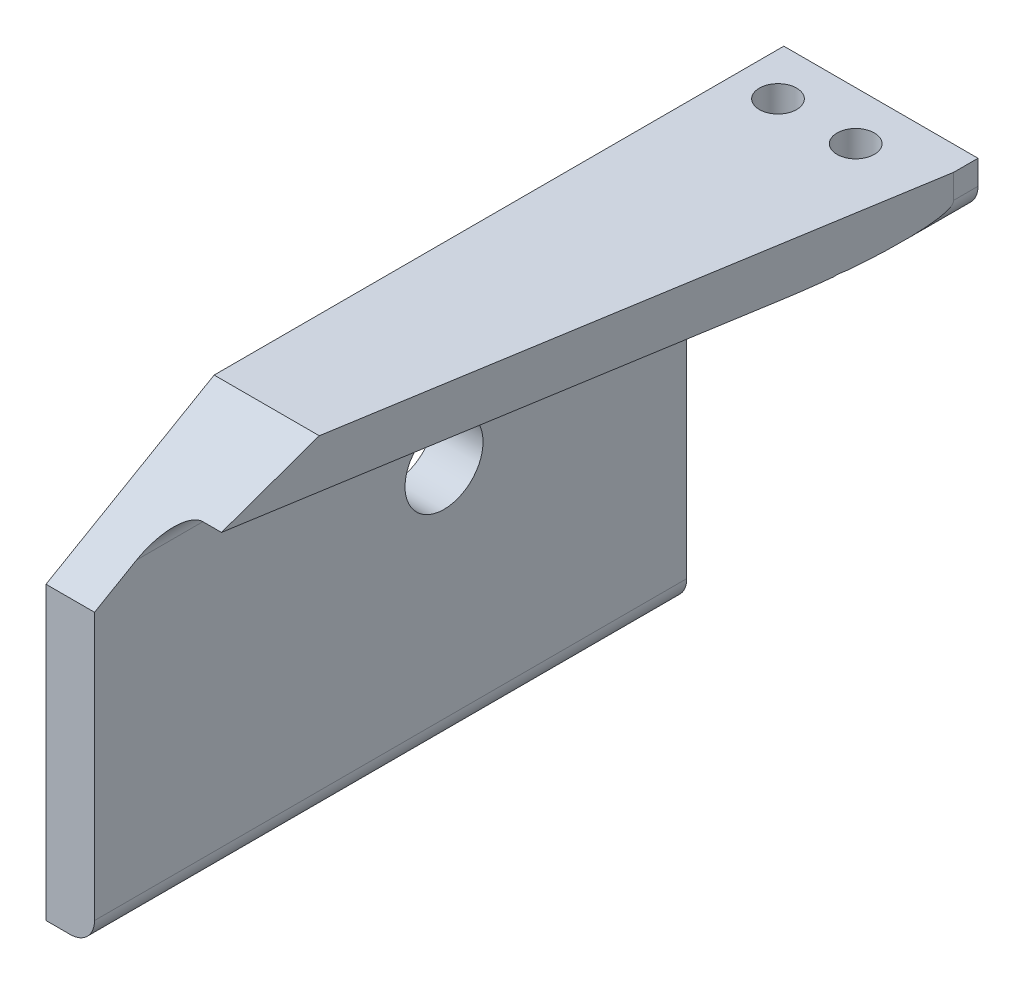
from build123d import *

# Parameters (mm, degrees)
BOSS_EXTRUDE1_DEPTH = 48.26
SKETCH2_W           = 9.525
SKETCH2_H           = 22.352
CUT_EXTRUDE1_DEPTH  = 56.99533552
SKETCH3_R           = 1.2192
CUT_EXTRUDE2_DEPTH  = 56.99533552
FILLET2_R           = 1.5875
SKETCH4_R           = 2.5527
CUT_EXTRUDE3_DEPTH  = 56.995335629
CUT_EXTRUDE4_DEPTH  = 56.995335629
CHAMFER2_SIZE       = 6.35
CHAMFER2_SIZE2      = 10.998522628


with BuildPart() as part:
    # Sketch1 → Boss-Extrude1 (new body)
    with BuildSketch(Plane.XY):
        with BuildLine():
            Line((0, 0), (0, -25.4))
            Line((0, -25.4), (1.5875, -25.4))
            ThreePointArc((1.5875, -25.4), (2.710032015, -24.935032015), (3.175, -23.8125))
            Line((3.175, -23.8125), (3.175, -4.7625))
            ThreePointArc((3.175, -4.7625), (3.639967985, -3.639967985), (4.7625, -3.175))
            Line((4.7625, -3.175), (11.1125, -3.175))
            ThreePointArc((11.1125, -3.175), (12.235032015, -2.710032015), (12.7, -1.5875))
            Line((12.7, -1.5875), (12.7, 0))
            Line((12.7, 0), (0, 0))
        make_face()
    extrude(amount=BOSS_EXTRUDE1_DEPTH)

    # Sketch2 → Cut-Extrude1 (cut, through all)
    with BuildSketch(Plane(origin=(0, 0, 0), x_dir=(0, 0, -1), z_dir=(1, 0, 0))):
        with Locations((-4.7625, -14.224)):
            Rectangle(SKETCH2_W, SKETCH2_H)
    extrude(amount=CUT_EXTRUDE1_DEPTH, mode=Mode.SUBTRACT)

    # Sketch3 → Cut-Extrude2 (cut, through all)
    with BuildSketch(Plane(origin=(0, 0, 0), x_dir=(1, 0, 0), z_dir=(0, 1, 0))):
        with Locations(Location((2.794, -3.175, 0), (0, 0, 180))):
            Circle(SKETCH3_R)
        with Locations(Location((7.874, -3.175, 0), (0, 0, 180))):
            Circle(SKETCH3_R)
    extrude(amount=-CUT_EXTRUDE2_DEPTH, mode=Mode.SUBTRACT)

    # Fillet2
    fillet2_edges = [part.edges().sort_by_distance(p)[0] for p in [
        (5.867335197, -3.048, 9.525),
    ]]
    fillet(fillet2_edges, radius=FILLET2_R)

    # Sketch4 → Cut-Extrude3 (cut, through all)
    with BuildSketch(Plane.ZY):
        with Locations(Location((25.4, -9.398, 0), (0, 0, 270))):
            Circle(SKETCH4_R)
    extrude(amount=-CUT_EXTRUDE3_DEPTH, mode=Mode.SUBTRACT)

    # Sketch6 → Cut-Extrude4 (cut, through all)
    with BuildSketch(Plane(origin=(0, 0, 0), x_dir=(1, 0, 0), z_dir=(0, 1, 0))):
        Polygon((5.08, -48.26), (12.7, -1.5875), (12.7, -48.26), align=None)
    extrude(amount=-CUT_EXTRUDE4_DEPTH, mode=Mode.SUBTRACT)

    # Chamfer2
    chamfer2_edges = [part.edges().sort_by_distance(p)[0] for p in [
        (2.54, 0, 48.26),
    ]]
    chamfer2_side = [part.faces().sort_by_distance(p)[0] for p in [
        (1.769133551, -11.790484545, 48.26),
    ]]
    chamfer(chamfer2_edges, length=CHAMFER2_SIZE, length2=CHAMFER2_SIZE2, reference=chamfer2_side[0])


solid = part.part
